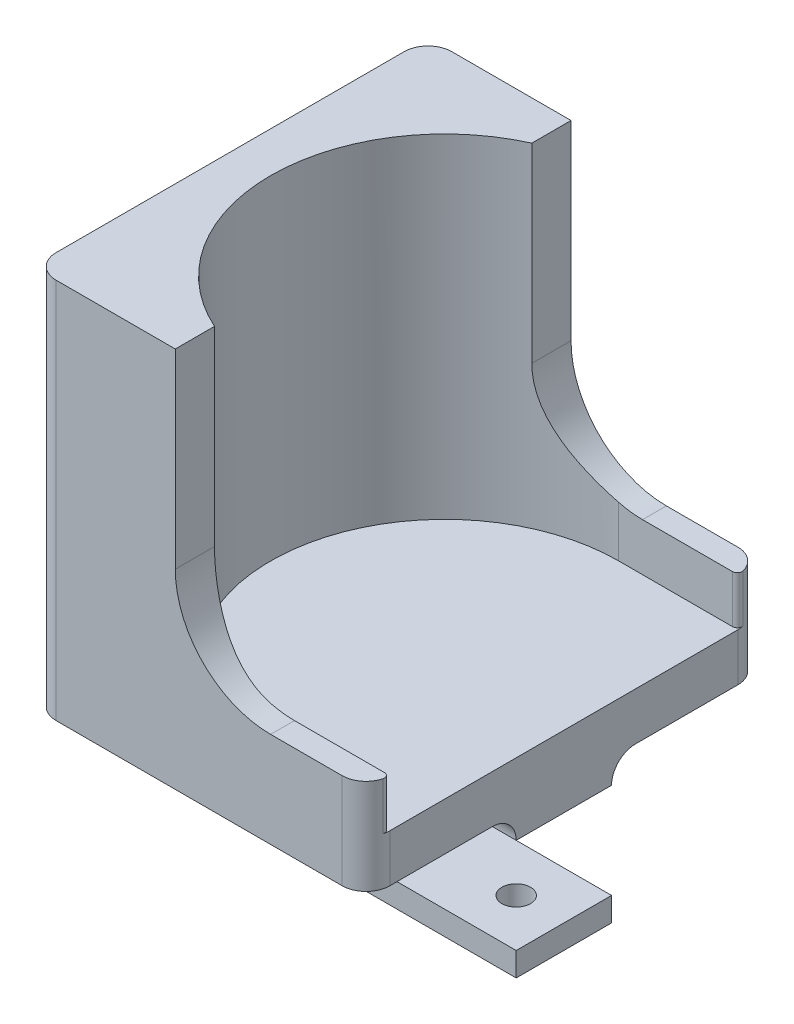
from build123d import *

# Parameters (mm, degrees)
EXTRUDE_1_DEPTH     = 10
EXTRUDE_2_DEPTH     = 70
SKETCH_6_W          = 70
SKETCH_6_H          = 20
EXTRUDE_3_DEPTH     = 30
SKETCH_8_R          = 3
CUT_EXTRUDE_5_DEPTH = 15
FILLET_2_R          = 5
SKETCH_9_W          = 20
SKETCH_9_H          = 20
CUT_EXTRUDE_6_DEPTH = 30
FILLET_4_R          = 2
CUT_EXTRUDE_7_DEPTH = 121.474063599


with BuildPart() as part:
    # 草圖2 → 填料-伸長1 (new body)
    with BuildSketch(Plane(origin=(0, 0, 0), x_dir=(1, 0, 0), z_dir=(0, 1, 0))):
        with BuildLine():
            Line((-30, 41.5), (30, 41.5))
            ThreePointArc((30, 41.5), (33.535533906, 40.035533906), (35, 36.5))
            Line((35, 36.5), (35, -36.5))
            ThreePointArc((35, -36.5), (33.535533906, -40.035533906), (30, -41.5))
            Line((30, -41.5), (-30, -41.5))
            ThreePointArc((-30, -41.5), (-33.535533906, -40.035533906), (-35, -36.5))
            Line((-35, -36.5), (-35, 36.5))
            ThreePointArc((-35, 36.5), (-33.535533906, 40.035533906), (-30, 41.5))
        make_face()
    extrude(amount=EXTRUDE_1_DEPTH)

    # 草圖3 → 填料-伸長2 (add)
    with BuildSketch(Plane(origin=(0, 10, 0), x_dir=(1, 0, 0), z_dir=(0, 1, 0))):
        with BuildLine():
            Line((-35, 36.5), (-35, -36.5))
            ThreePointArc((-35, -36.5), (-33.535533906, -40.035533906), (-30, -41.5))
            Line((-30, -41.5), (30, -41.5))
            ThreePointArc((30, -41.5), (33.061862178, -40.452847075), (34.841229183, -37.75))
            ThreePointArc((34.841229183, -37.75), (34.663552761, -36.887627564), (33.872983346, -36.5))
            Line((33.872983346, -36.5), (10, -36.5))
            ThreePointArc((10, -36.5), (-26.5, 0), (10, 36.5))
            Line((10, 36.5), (33.872983346, 36.5))
            ThreePointArc((33.872983346, 36.5), (34.663552761, 36.887627564), (34.841229183, 37.75))
            ThreePointArc((34.841229183, 37.75), (33.061862178, 40.452847075), (30, 41.5))
            Line((30, 41.5), (-30, 41.5))
            ThreePointArc((-30, 41.5), (-33.535533906, 40.035533906), (-35, 36.5))
        make_face()
    extrude(amount=EXTRUDE_2_DEPTH)

    # 草圖6 → 填料-伸長3 (add)
    with BuildSketch(Plane.XZ):
        Rectangle(SKETCH_6_W, SKETCH_6_H)
    extrude(amount=EXTRUDE_3_DEPTH)

    # 草圖8 → 除料-伸長5 (cut)
    with BuildSketch(Plane.XZ.offset(30)):
        with Locations(Location((25, 0, 0), (0, 0, 270))):
            Circle(SKETCH_8_R)
    extrude(amount=-CUT_EXTRUDE_5_DEPTH, mode=Mode.SUBTRACT)

    # 圓角2
    fillet_2_edges = [part.edges().sort_by_distance(p)[0] for p in [
        (0, 0, -10),
        (0, 0, 10),
    ]]
    fillet(fillet_2_edges, radius=FILLET_2_R)

    # 草圖9 → 除料-伸長6 (cut)
    with BuildSketch(Plane(origin=(35, 0, 0), x_dir=(0, 0, -1), z_dir=(1, 0, 0))):
        with Locations((0, -15)):
            Rectangle(SKETCH_9_W, SKETCH_9_H)
    extrude(amount=-CUT_EXTRUDE_6_DEPTH, mode=Mode.SUBTRACT)

    # 圓角4
    fillet_4_edges = [part.edges().sort_by_distance(p)[0] for p in [
        (5, -25, 0),
        (5, -5, 0),
    ]]
    fillet(fillet_4_edges, radius=FILLET_4_R)

    # 草圖10 → 除料-伸長7 (cut, through all)
    with BuildSketch(Plane.XY.offset(41.5)):
        with BuildLine():
            Line((35, 80), (-5, 80))
            Line((-5, 80), (-5, 40))
            ThreePointArc((-5, 40), (0.857864376, 25.857864376), (15, 20))
            Line((15, 20), (35, 20))
            Line((35, 20), (35, 80))
        make_face()
    extrude(amount=-CUT_EXTRUDE_7_DEPTH, mode=Mode.SUBTRACT)


solid = part.part
